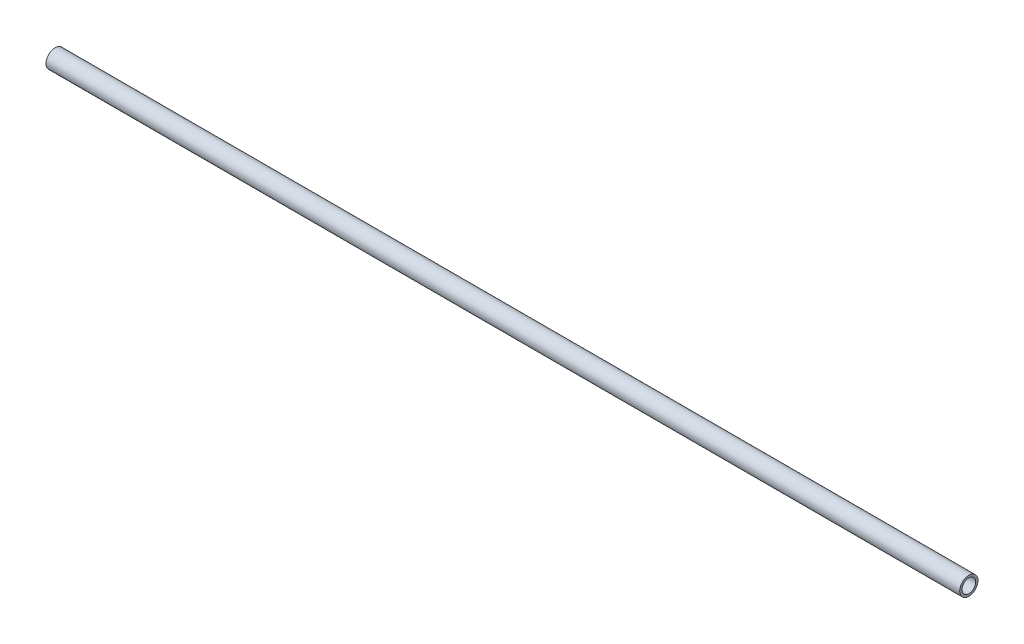
from build123d import *

# Parameters (mm, degrees)
SKETCH_1_R      = 4
SKETCH_1_R_2    = 3
EXTRUDE_1_DEPTH = 200


with BuildPart() as part:
    # 草图1 → 凸台-拉伸1 (new, symmetric)
    with BuildSketch(Plane(origin=(0, 0, 0), x_dir=(0, 0, -1), z_dir=(1, 0, 0))):
        Circle(SKETCH_1_R)
        Circle(SKETCH_1_R_2, mode=Mode.SUBTRACT)
    extrude(amount=EXTRUDE_1_DEPTH, both=True)


solid = part.part
